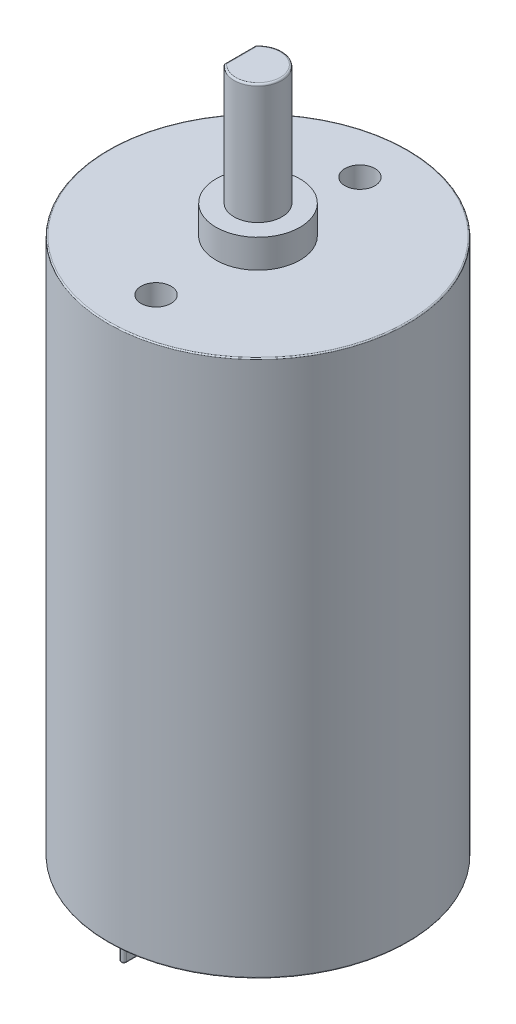
from build123d import *

# Parameters (mm, degrees)
ESBO_O2_R                 = 12.5
RESSALTO_EXTRUS_O2_DEPTH  = 44.8
RESSALTO_EXTRUS_O7_DEPTH  = 3.5
FILETE9_R                 = 0.1
ESBO_O7_5_R               = 3
RESSALTO_EXTRUS_O8_DEPTH  = 2.6
FILETE10_R                = 1
FURO_ROSCADO_DE_M31_D     = 2.5
FURO_ROSCADO_DE_M31_DEPTH = 3.5
FURO_ROSCADO_DE_M31_TIP   = 0.751075774
ESBO_O11_2_R              = 3.5
ESBO_O11_2_R_2            = 2
RESSALTO_EXTRUS_O9_DEPTH  = 2.38
ESBO_O11_4_R              = 2
RESSALTO_EXTRUS_O10_DEPTH = 12.38
CORTE_EXTRUS_O1_START     = -8
CORTE_EXTRUS_O1_DEPTH     = 8
FILETE11_R                = 0.15


with BuildPart() as part:
    # Esboço2 → Ressalto-extrusão2 (new body)
    with BuildSketch(Plane(origin=(0, 0, 0), x_dir=(1, 0, 0), z_dir=(0, 1, 0))):
        with Locations(Location((0, 0, 0), (0, 0, 270))):
            Circle(ESBO_O2_R)
    extrude(amount=RESSALTO_EXTRUS_O2_DEPTH)

    # Esboço7 → Ressalto-extrusão7 (add)
    with BuildSketch(Plane.XZ):
        with BuildLine():
            Line((-1.283346754, 9.689860485), (-1.283346754, 8.310139515))
            ThreePointArc((-1.283346754, 8.310139515), (-1.500488621, 8.092997649), (-1.717630487, 8.310139515))
            Line((-1.717630487, 8.310139515), (-1.717630487, 9.689860485))
            ThreePointArc((-1.717630487, 9.689860485), (-1.500488621, 9.907002351), (-1.283346754, 9.689860485))
        make_face()
        with BuildLine():
            Line((1.717141867, -8.310139515), (1.717141867, -9.689860485))
            ThreePointArc((1.717141867, -9.689860485), (1.5, -9.907002351), (1.282858133, -9.689860485))
            Line((1.282858133, -9.689860485), (1.282858133, -8.310139515))
            ThreePointArc((1.282858133, -8.310139515), (1.5, -8.092997649), (1.717141867, -8.310139515))
        make_face()
    extrude(amount=RESSALTO_EXTRUS_O7_DEPTH)

    # Filete9
    filete9_edges = [part.edges().sort_by_distance(p)[0] for p in [
        (1.717141867, -3.5, -9),
        (1.5, -3.5, -8.092997649),
        (1.282858133, -3.5, -9),
        (1.5, -3.5, -9.907002351),
        (-1.283346754, -3.5, 9),
        (-1.500488621, -3.5, 9.907002351),
        (-1.717630487, -3.5, 9),
        (-1.500488621, -3.5, 8.092997649),
        (0, 0, -12.5),
        (0, 44.8, -12.5),
    ]]
    fillet(filete9_edges, radius=FILETE9_R)

    # Esboço7<5> → Ressalto-extrusão8 (add)
    with BuildSketch(Plane.XZ):
        with Locations(Location((0, 0, 0), (0, 0, 90))):
            Circle(ESBO_O7_5_R)
    extrude(amount=RESSALTO_EXTRUS_O8_DEPTH)

    # Filete10
    filete10_edges = [part.edges().sort_by_distance(p)[0] for p in [
        (0, -2.6, -3),
    ]]
    fillet(filete10_edges, radius=FILETE10_R)

    # Furo roscado de M31
    with Locations(Plane(origin=(0, 44.8, 0), x_dir=(1, 0, 0), z_dir=(0, 1, 0))):
        with Locations((0, -8.5), (0, 8.5)):
            Hole(FURO_ROSCADO_DE_M31_D / 2, depth=FURO_ROSCADO_DE_M31_DEPTH)
            with Locations((0, 0, -(FURO_ROSCADO_DE_M31_DEPTH + FURO_ROSCADO_DE_M31_TIP / 2))):  # 118° drill point
                Cone(0, FURO_ROSCADO_DE_M31_D / 2, FURO_ROSCADO_DE_M31_TIP, mode=Mode.SUBTRACT)

    # Esboço11<2> → Ressalto-extrusão9 (add)
    with BuildSketch(Plane(origin=(0, 44.8, 0), x_dir=(1, 0, 0), z_dir=(0, 1, 0))):
        with Locations(Location((0, 0, 0), (0, 0, 270))):
            Circle(ESBO_O11_2_R)
        with Locations(Location((0, 0, 0), (0, 0, 270))):
            Circle(ESBO_O11_2_R_2, mode=Mode.SUBTRACT)
    extrude(amount=RESSALTO_EXTRUS_O9_DEPTH)

    # Esboço11<4> → Ressalto-extrusão10 (add)
    with BuildSketch(Plane(origin=(0, 44.8, 0), x_dir=(1, 0, 0), z_dir=(0, 1, 0))):
        with Locations(Location((0, 0, 0), (0, 0, 270))):
            Circle(ESBO_O11_4_R)
    extrude(amount=RESSALTO_EXTRUS_O10_DEPTH)

    # Esboço13 → Corte-extrusão1 (cut)
    with BuildSketch(Plane(origin=(0, 57.18, 0), x_dir=(1, 0, 0), z_dir=(0, 1, 0)).offset(CORTE_EXTRUS_O1_START)):
        with BuildLine():
            Line((-1.510503721, 1.310869372), (-1.510503721, -1.310869372))
            ThreePointArc((-1.510503721, -1.310869372), (-2, 0), (-1.510503721, 1.310869372))
        make_face()
    extrude(amount=CORTE_EXTRUS_O1_DEPTH, mode=Mode.SUBTRACT)

    # Filete11
    filete11_edges = [part.edges().sort_by_distance(p)[0] for p in [
        (1.819579449, 57.18, -0.830138921),
        (-1.510503721, 57.18, 0),
    ]]
    fillet(filete11_edges, radius=FILETE11_R)


solid = part.part
